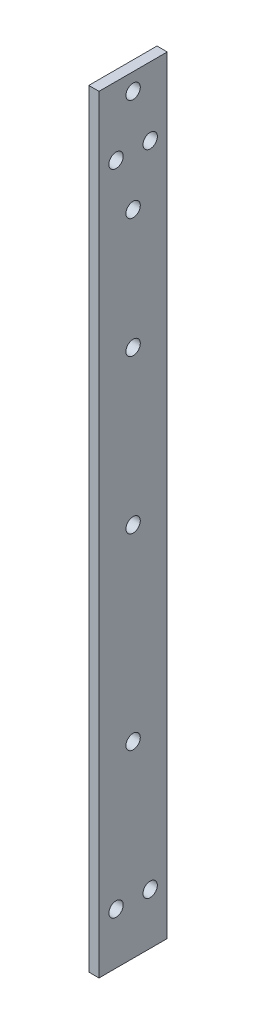
from build123d import *

# Parameters (mm, degrees)
SKETCH_1_W      = 225
SKETCH_1_H      = 20
SKETCH_1_R      = 2.1
EXTRUDE_1_DEPTH = 3


with BuildPart() as part:
    # 草图1 → 凸台-拉伸1 (new body)
    with BuildSketch(Plane(origin=(-39, 0, 0), x_dir=(0, -1, 0), z_dir=(-1, 0, 0))):
        with Locations((-107.5, 10)):
            Rectangle(SKETCH_1_W, SKETCH_1_H)
        with Locations(Location((-215, 10, 0), (0, 0, 270))):
            Circle(SKETCH_1_R, mode=Mode.SUBTRACT)
        with Locations(Location((-200, 15, 0), (0, 0, 270))):
            Circle(SKETCH_1_R, mode=Mode.SUBTRACT)
        with Locations(Location((-185, 10, 0), (0, 0, 270))):
            Circle(SKETCH_1_R, mode=Mode.SUBTRACT)
        with Locations(Location((-10, 5, 0), (0, 0, 270))):
            Circle(SKETCH_1_R, mode=Mode.SUBTRACT)
        with Locations(Location((-10, 15, 0), (0, 0, 270))):
            Circle(SKETCH_1_R, mode=Mode.SUBTRACT)
        with Locations(Location((-200, 5, 0), (0, 0, 270))):
            Circle(SKETCH_1_R, mode=Mode.SUBTRACT)
        with Locations(Location((-150, 10, 0), (0, 0, 270))):
            Circle(SKETCH_1_R, mode=Mode.SUBTRACT)
        with Locations(Location((-105, 10, 0), (0, 0, 270))):
            Circle(SKETCH_1_R, mode=Mode.SUBTRACT)
        with Locations(Location((-50, 10, 0), (0, 0, 270))):
            Circle(SKETCH_1_R, mode=Mode.SUBTRACT)
    extrude(amount=-EXTRUDE_1_DEPTH)


solid = part.part
